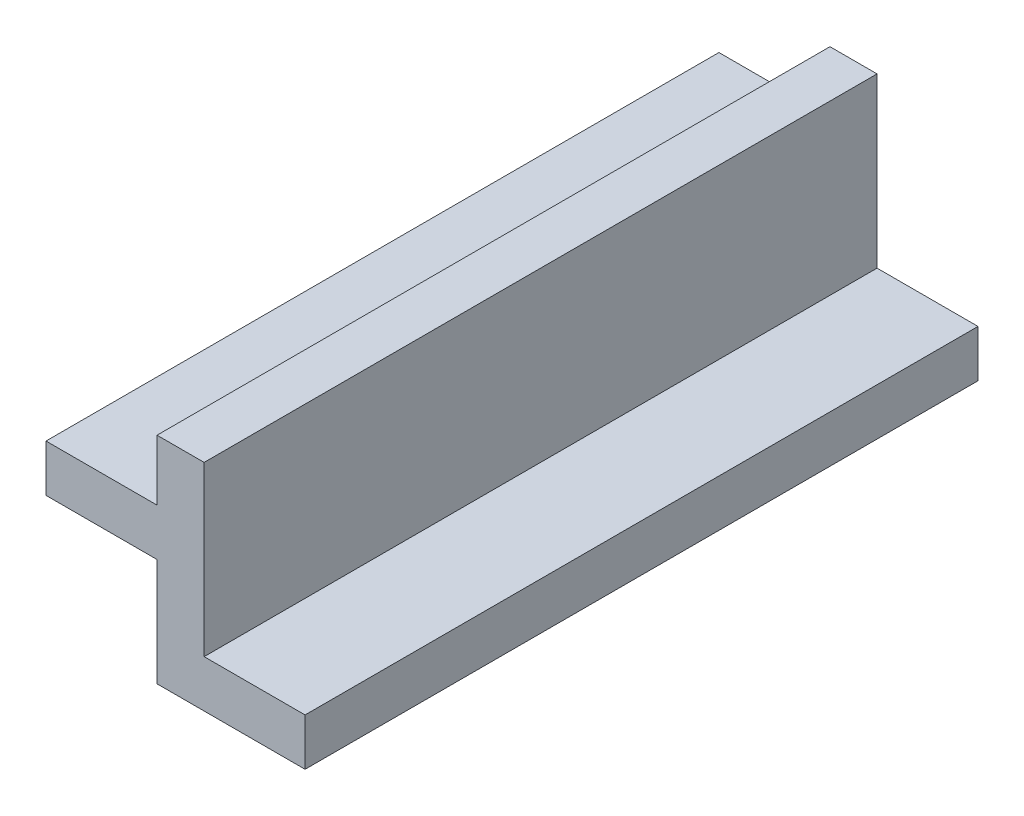
from build123d import *

# Parameters (mm, degrees)
SKETCH_1_W      = 16.5
SKETCH_1_H      = 7
SKETCH_1_W_2    = 3.5
SKETCH_1_W_3    = 15
EXTRUDE_1_DEPTH = 100


with BuildPart() as part:
    # Эскиз1 → Бобышка-Вытянуть1 (new body)
    with BuildSketch(Plane.XY):
        with Locations((-11.75, 3.5)):
            Rectangle(SKETCH_1_W, SKETCH_1_H)
        with Locations((-1.75, 3.5)):
            Rectangle(SKETCH_1_W_2, SKETCH_1_H)
        Polygon((-3.5, 0), (-3.5, -16), (3.5, -16), (3.5, -9), (3.5, 16), (-3.5, 16), (-3.5, 7), (0, 7), (0, 0), align=None)
        with Locations((11, -12.5)):
            Rectangle(SKETCH_1_W_3, SKETCH_1_H)
    extrude(amount=EXTRUDE_1_DEPTH)


solid = part.part
